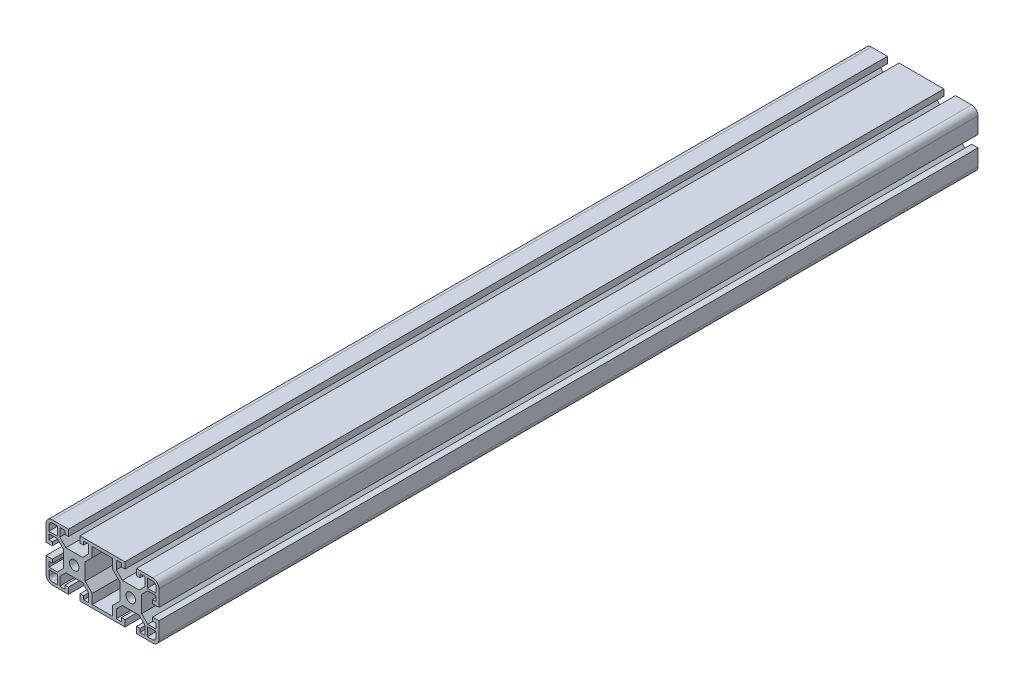
from build123d import *

# Parameters (mm, degrees)
SKETCH1_R           = 3.4
BOSS_EXTRUDE1_DEPTH = 580


with BuildPart() as part:
    # Sketch1 → Boss-Extrude1 (new body)
    with BuildSketch(Plane.XY):
        with BuildLine():
            Line((24.1, -20), (35.5, -20))
            ThreePointArc((35.5, -20), (38.681980515, -18.681980515), (40, -15.5))
            Line((40, -15.5), (40, -4.1))
            Line((40, -4.1), (35.5, -4.1))
            Line((35.5, -4.1), (35.5, -6.6))
            Line((35.5, -6.6), (38, -6.6))
            Line((38, -6.6), (38, -10.25))
            Line((38, -10.25), (32.017766953, -10.25))
            Line((32.017766953, -10.25), (27.7, -5.932233047))
            Line((27.7, -5.932233047), (27.7, 5.932233047))
            Line((27.7, 5.932233047), (32.017766953, 10.25))
            Line((32.017766953, 10.25), (38, 10.25))
            Line((38, 10.25), (38, 6.6))
            Line((38, 6.6), (35.5, 6.6))
            Line((35.5, 6.6), (35.5, 4.1))
            Line((35.5, 4.1), (40, 4.1))
            Line((40, 4.1), (40, 15.5))
            ThreePointArc((40, 15.5), (38.681980515, 18.681980515), (35.5, 20))
            Line((35.5, 20), (24.1, 20))
            Line((24.1, 20), (24.1, 15.5))
            Line((24.1, 15.5), (26.6, 15.5))
            Line((26.6, 15.5), (26.6, 18))
            Line((26.6, 18), (30.25, 18))
            Line((30.25, 18), (30.25, 12.017766953))
            Line((30.25, 12.017766953), (25.932233047, 7.7))
            Line((25.932233047, 7.7), (14.067766953, 7.7))
            Line((14.067766953, 7.7), (9.75, 12.017766953))
            Line((9.75, 12.017766953), (9.75, 18))
            Line((9.75, 18), (13.4, 18))
            Line((13.4, 18), (13.4, 15.5))
            Line((13.4, 15.5), (15.9, 15.5))
            Line((15.9, 15.5), (15.9, 20))
            Line((15.9, 20), (-15.9, 20))
            Line((-15.9, 20), (-15.9, 15.5))
            Line((-15.9, 15.5), (-13.4, 15.5))
            Line((-13.4, 15.5), (-13.4, 18))
            Line((-13.4, 18), (-9.75, 18))
            Line((-9.75, 18), (-9.75, 12.017766953))
            Line((-9.75, 12.017766953), (-14.067766953, 7.7))
            Line((-14.067766953, 7.7), (-25.932233047, 7.7))
            Line((-25.932233047, 7.7), (-30.25, 12.017766953))
            Line((-30.25, 12.017766953), (-30.25, 18))
            Line((-30.25, 18), (-26.6, 18))
            Line((-26.6, 18), (-26.6, 15.5))
            Line((-26.6, 15.5), (-24.1, 15.5))
            Line((-24.1, 15.5), (-24.1, 20))
            Line((-24.1, 20), (-35.5, 20))
            ThreePointArc((-35.5, 20), (-38.681980515, 18.681980515), (-40, 15.5))
            Line((-40, 15.5), (-40, 4.1))
            Line((-40, 4.1), (-35.5, 4.1))
            Line((-35.5, 4.1), (-35.5, 6.6))
            Line((-35.5, 6.6), (-38, 6.6))
            Line((-38, 6.6), (-38, 10.25))
            Line((-38, 10.25), (-32.017766953, 10.25))
            Line((-32.017766953, 10.25), (-27.7, 5.932233047))
            Line((-27.7, 5.932233047), (-27.7, -5.932233047))
            Line((-27.7, -5.932233047), (-32.017766953, -10.25))
            Line((-32.017766953, -10.25), (-38, -10.25))
            Line((-38, -10.25), (-38, -6.6))
            Line((-38, -6.6), (-35.5, -6.6))
            Line((-35.5, -6.6), (-35.5, -4.1))
            Line((-35.5, -4.1), (-40, -4.1))
            Line((-40, -4.1), (-40, -15.5))
            ThreePointArc((-40, -15.5), (-38.681980515, -18.681980515), (-35.5, -20))
            Line((-35.5, -20), (-24.1, -20))
            Line((-24.1, -20), (-24.1, -15.5))
            Line((-24.1, -15.5), (-26.6, -15.5))
            Line((-26.6, -15.5), (-26.6, -18))
            Line((-26.6, -18), (-30.25, -18))
            Line((-30.25, -18), (-30.25, -12.017766953))
            Line((-30.25, -12.017766953), (-25.932233047, -7.7))
            Line((-25.932233047, -7.7), (-14.067766953, -7.7))
            Line((-14.067766953, -7.7), (-9.75, -12.017766953))
            Line((-9.75, -12.017766953), (-9.75, -18))
            Line((-9.75, -18), (-13.4, -18))
            Line((-13.4, -18), (-13.4, -15.5))
            Line((-13.4, -15.5), (-15.9, -15.5))
            Line((-15.9, -15.5), (-15.9, -20))
            Line((-15.9, -20), (15.9, -20))
            Line((15.9, -20), (15.9, -15.5))
            Line((15.9, -15.5), (13.4, -15.5))
            Line((13.4, -15.5), (13.4, -18))
            Line((13.4, -18), (9.75, -18))
            Line((9.75, -18), (9.75, -12.017766953))
            Line((9.75, -12.017766953), (14.067766953, -7.7))
            Line((14.067766953, -7.7), (25.932233047, -7.7))
            Line((25.932233047, -7.7), (30.25, -12.017766953))
            Line((30.25, -12.017766953), (30.25, -18))
            Line((30.25, -18), (26.6, -18))
            Line((26.6, -18), (26.6, -15.5))
            Line((26.6, -15.5), (24.1, -15.5))
            Line((24.1, -15.5), (24.1, -20))
        make_face()
        with Locations((-20, 0)):
            Circle(SKETCH1_R, mode=Mode.SUBTRACT)
        with Locations((20, 0)):
            Circle(SKETCH1_R, mode=Mode.SUBTRACT)
        with BuildLine():
            Line((38, -15.5), (38, -11.75))
            Line((38, -11.75), (31.75, -11.75))
            Line((31.75, -11.75), (31.75, -18))
            Line((31.75, -18), (35.5, -18))
            ThreePointArc((35.5, -18), (37.267766953, -17.267766953), (38, -15.5))
        make_face(mode=Mode.SUBTRACT)
        with BuildLine():
            Line((-38, 15.5), (-38, 11.75))
            Line((-38, 11.75), (-31.75, 11.75))
            Line((-31.75, 11.75), (-31.75, 18))
            Line((-31.75, 18), (-35.5, 18))
            ThreePointArc((-35.5, 18), (-37.267766953, 17.267766953), (-38, 15.5))
        make_face(mode=Mode.SUBTRACT)
        Polygon((-7.25, -10.982233047), (-7.25, -17.8), (7.25, -17.8), (7.25, -10.982233047), (12.3, -5.932233047), (12.3, 5.932233047), (7.25, 10.982233047), (7.25, 17.8), (-7.25, 17.8), (-7.25, 10.982233047), (-12.3, 5.932233047), (-12.3, -5.932233047), align=None, mode=Mode.SUBTRACT)
        with BuildLine():
            Line((-35.5, -18), (-31.75, -18))
            Line((-31.75, -18), (-31.75, -11.75))
            Line((-31.75, -11.75), (-38, -11.75))
            Line((-38, -11.75), (-38, -15.5))
            ThreePointArc((-38, -15.5), (-37.267766953, -17.267766953), (-35.5, -18))
        make_face(mode=Mode.SUBTRACT)
        with BuildLine():
            Line((35.5, 18), (31.75, 18))
            Line((31.75, 18), (31.75, 11.75))
            Line((31.75, 11.75), (38, 11.75))
            Line((38, 11.75), (38, 15.5))
            ThreePointArc((38, 15.5), (37.267766953, 17.267766953), (35.5, 18))
        make_face(mode=Mode.SUBTRACT)
    extrude(amount=BOSS_EXTRUDE1_DEPTH)


solid = part.part
